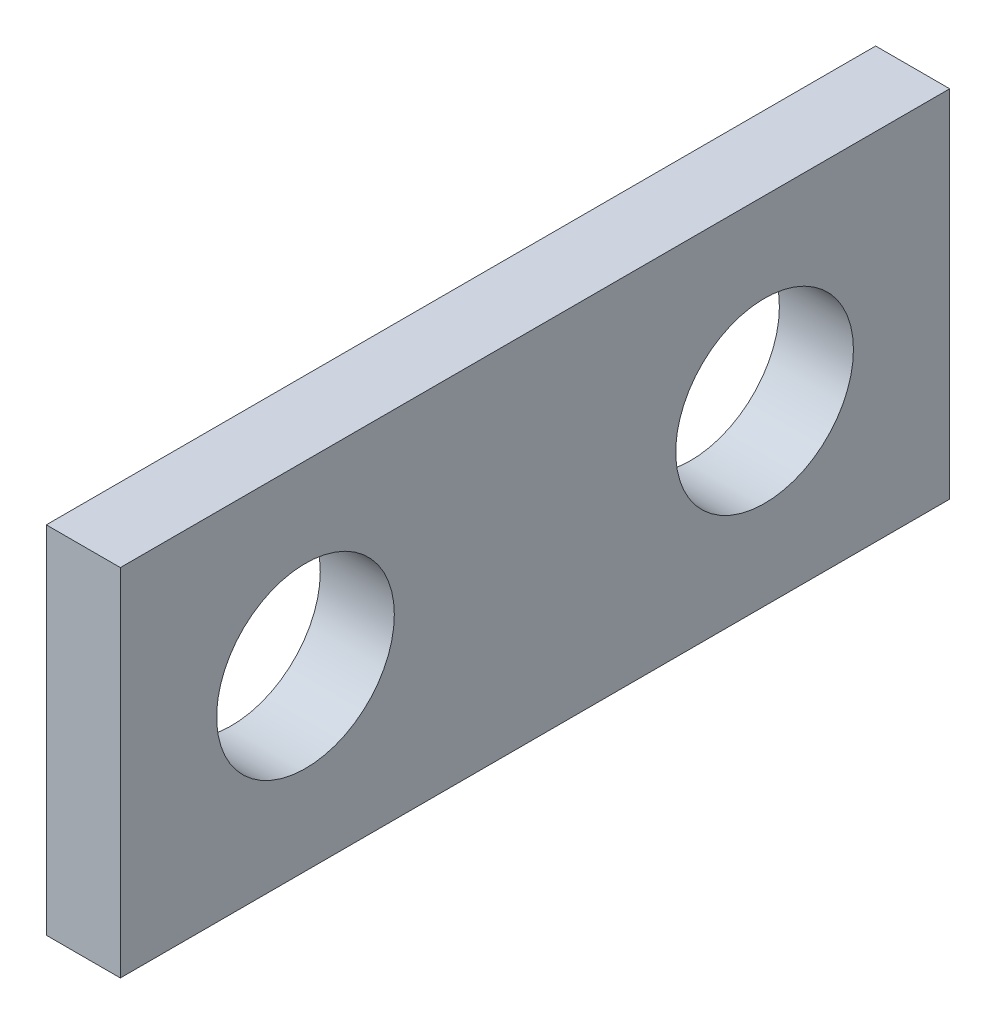
from build123d import *

# Parameters (mm, degrees)
SKETCH1_W           = 56
SKETCH1_H           = 24
SKETCH1_R           = 6
BOSS_EXTRUDE1_DEPTH = 5


with BuildPart() as part:
    # Sketch1 → Boss-Extrude1 (new body)
    with BuildSketch(Plane(origin=(0, 0, 0), x_dir=(0, 0, -1), z_dir=(1, 0, 0))):
        Rectangle(SKETCH1_W, SKETCH1_H)
        with Locations((-15.5, 0)):
            Circle(SKETCH1_R, mode=Mode.SUBTRACT)
        with Locations((15.5, 0)):
            Circle(SKETCH1_R, mode=Mode.SUBTRACT)
    extrude(amount=BOSS_EXTRUDE1_DEPTH)


solid = part.part
